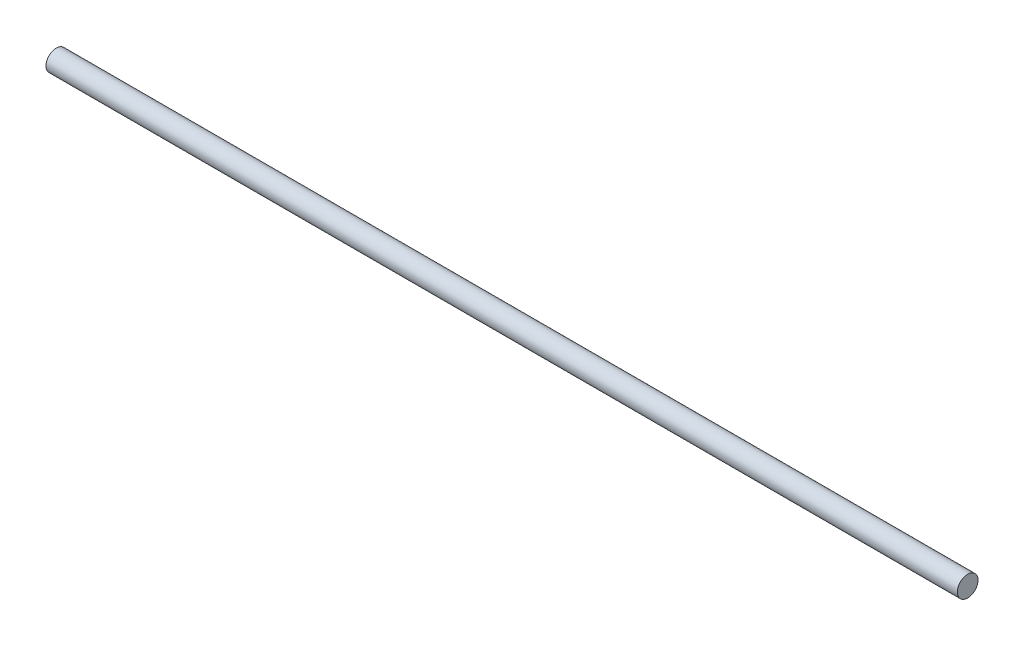
from build123d import *

# Parameters (mm, degrees)
SKETCH5_R = 1.5875


with BuildPart() as part:
    # Sweep1: sweep along a path in Sketch4
    with BuildLine(Plane.XY) as sweep1_path:
        Line((0, 0), (140, 0))
    # Sketch5 → Sweep1 (sweep)
    with BuildSketch(Plane(origin=(0, 0, 0), x_dir=(0, 0, -1), z_dir=(1, 0, 0))):
        Circle(SKETCH5_R)
    sweep(path=sweep1_path.line)


solid = part.part
